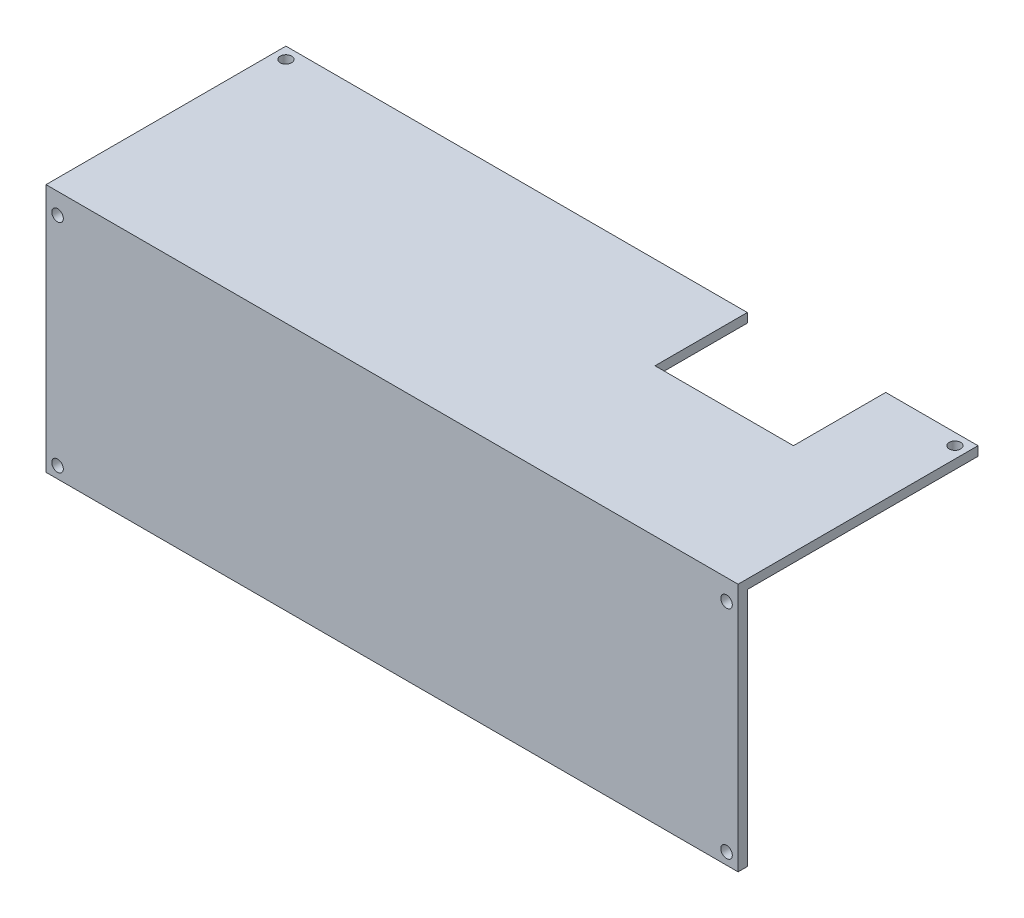
from build123d import *

# Parameters (mm, degrees)
SKIZZE1_R                       = 1.25
AUFSATZ_LINEAR_AUSTRAGEN1_DEPTH = 2
SKIZZE2_W                       = 150
SKIZZE2_H                       = 52
AUFSATZ_LINEAR_AUSTRAGEN2_DEPTH = 2
SKIZZE3_W                       = 30
SKIZZE3_H                       = 20
SCHNITT_LINEAR_AUSTRAGEN1_DEPTH = 2
SKIZZE5_R                       = 1.25
SCHNITT_LINEAR_AUSTRAGEN2_DEPTH = 2


with BuildPart() as part:
    # Skizze1 → Aufsatz-Linear austragen1 (new body)
    # profile 1 of 2: a face of its own
    with BuildSketch(Plane.XY):
        with BuildLine():
            Line((148, 39.858571571), (148, 12.141428429))
            ThreePointArc((148, 12.141428429), (147.219544457, 8.268445082), (145, 5))
            ThreePointArc((145, 5), (141.731554918, 2.780455543), (137.858571571, 2))
            Line((137.858571571, 2), (12.141428429, 2))
            ThreePointArc((12.141428429, 2), (8.268445082, 2.780455543), (5, 5))
            ThreePointArc((5, 5), (2.780455543, 8.268445082), (2, 12.141428429))
            Line((2, 12.141428429), (2, 39.858571571))
            ThreePointArc((2, 39.858571571), (2.780455543, 43.731554918), (5, 47))
            Line((5, 47), (5, 52))
            Line((5, 52), (145, 52))
            Line((145, 52), (145, 47))
            ThreePointArc((145, 47), (147.219544457, 43.731554918), (148, 39.858571571))
        make_face()
    # profile 2 of 2: a face of its own
    with BuildSketch(Plane.XY):
        with BuildLine():
            ThreePointArc((148, 39.858571571), (147.219544457, 43.731554918), (145, 47))
            Line((145, 47), (145, 52))
            Line((145, 52), (150, 52))
            Line((150, 52), (150, 0))
            Line((150, 0), (0, 0))
            Line((0, 0), (0, 52))
            Line((0, 52), (5, 52))
            Line((5, 52), (5, 47))
            ThreePointArc((5, 47), (2.780455543, 43.731554918), (2, 39.858571571))
            Line((2, 39.858571571), (2, 12.141428429))
            ThreePointArc((2, 12.141428429), (2.780455543, 8.268445082), (5, 5))
            ThreePointArc((5, 5), (8.268445082, 2.780455543), (12.141428429, 2))
            Line((12.141428429, 2), (137.858571571, 2))
            ThreePointArc((137.858571571, 2), (141.731554918, 2.780455543), (145, 5))
            ThreePointArc((145, 5), (147.219544457, 8.268445082), (148, 12.141428429))
            Line((148, 12.141428429), (148, 39.858571571))
        make_face()
        with Locations((2.5, 49.5)):
            Circle(SKIZZE1_R, mode=Mode.SUBTRACT)
        with Locations((2.5, 2.5)):
            Circle(SKIZZE1_R, mode=Mode.SUBTRACT)
        with Locations((147.5, 49.5)):
            Circle(SKIZZE1_R, mode=Mode.SUBTRACT)
        with Locations((147.5, 2.5)):
            Circle(SKIZZE1_R, mode=Mode.SUBTRACT)
    extrude(amount=AUFSATZ_LINEAR_AUSTRAGEN1_DEPTH)

    # Skizze2 → Aufsatz-Linear austragen2 (add)
    with BuildSketch(Plane(origin=(0, 52, 0), x_dir=(1, 0, 0), z_dir=(0, 1, 0))):
        with Locations((75, 24)):
            Rectangle(SKIZZE2_W, SKIZZE2_H)
    extrude(amount=AUFSATZ_LINEAR_AUSTRAGEN2_DEPTH)

    # Skizze3 → Schnitt-Linear austragen1 (cut)
    with BuildSketch(Plane.XZ.offset(-52)):
        with Locations((115, -40)):
            Rectangle(SKIZZE3_W, SKIZZE3_H)
    extrude(amount=-SCHNITT_LINEAR_AUSTRAGEN1_DEPTH, mode=Mode.SUBTRACT)

    # Skizze5 → Schnitt-Linear austragen2 (cut)
    with BuildSketch(Plane(origin=(0, 54, 0), x_dir=(1, 0, 0), z_dir=(0, 1, 0))):
        with Locations(Location((147.5, 47.5, 0), (0, 0, 270))):
            Circle(SKIZZE5_R)
        with Locations(Location((2.5, 47.5, 0), (0, 0, 270))):
            Circle(SKIZZE5_R)
    extrude(amount=-SCHNITT_LINEAR_AUSTRAGEN2_DEPTH, mode=Mode.SUBTRACT)


solid = part.part
